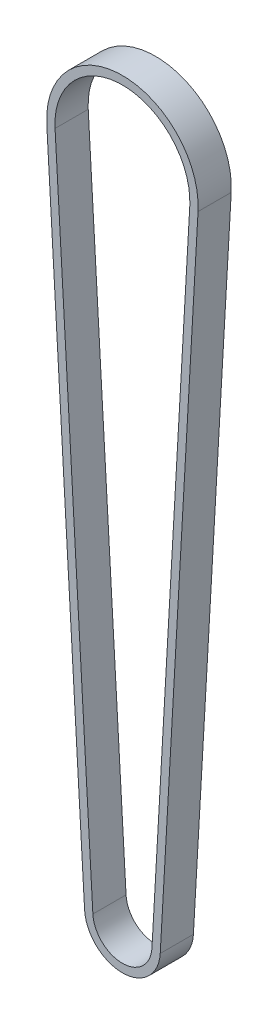
from build123d import *

# Parameters (mm, degrees)
EXTRUDE_THIN1_DEPTH = 3


with BuildPart() as part:
    # Sketch1 → Extrude-Thin1 (new, symmetric)
    with BuildSketch(Plane.XY):
        with BuildLine():
            Line((6.838830507, -60.391020833), (13.677661015, 59.217958333))
            ThreePointArc((13.677661015, 59.217958333), (0, 73.7), (-13.677661015, 59.217958333))
            Line((-13.677661015, 59.217958333), (-6.838830507, -60.391020833))
            ThreePointArc((-6.838830507, -60.391020833), (0, -66.85), (6.838830507, -60.391020833))
        make_face()
        with BuildLine():
            Line((5.341276382, -60.305395833), (12.180106889, 59.303583333))
            ThreePointArc((12.180106889, 59.303583333), (0, 72.2), (-12.180106889, 59.303583333))
            Line((-12.180106889, 59.303583333), (-5.341276382, -60.305395833))
            ThreePointArc((-5.341276382, -60.305395833), (0, -65.35), (5.341276382, -60.305395833))
        make_face(mode=Mode.SUBTRACT)
    extrude(amount=EXTRUDE_THIN1_DEPTH, both=True)


solid = part.part
